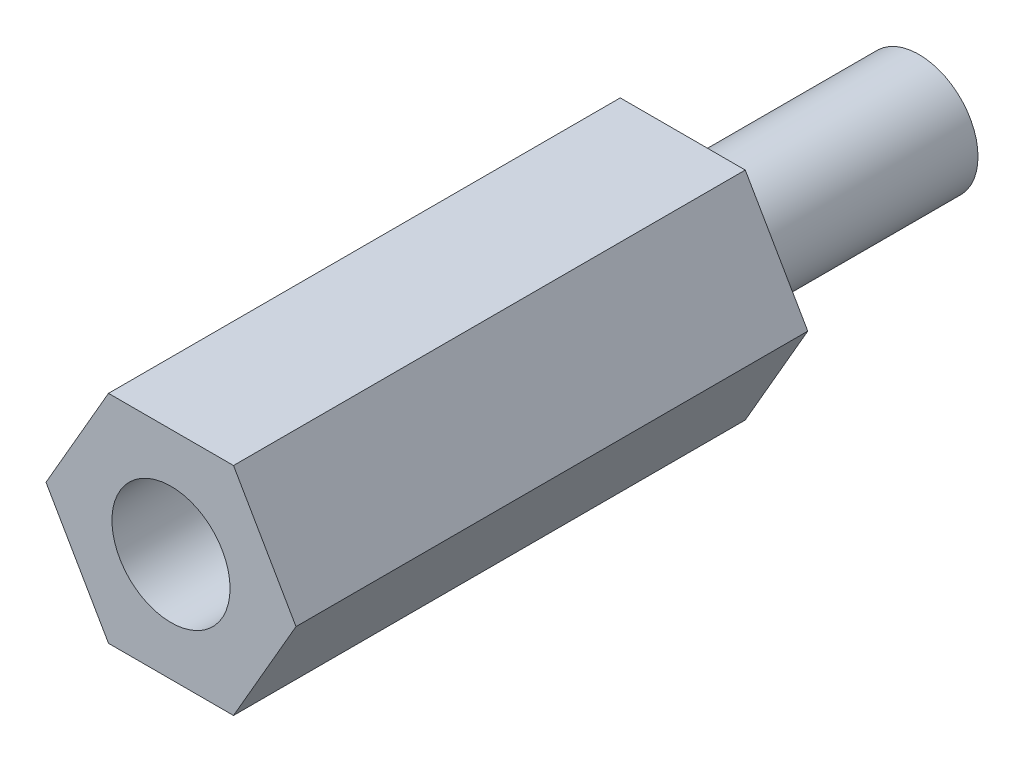
from build123d import *

# Parameters (mm, degrees)
BOSS_EXTRUDE1_DEPTH = 13
SKETCH1_3_R         = 1.5
BOSS_EXTRUDE2_DEPTH = 6
CUT_EXTRUDE1_START  = 13
SKETCH1_4_R         = 1.5
CUT_EXTRUDE1_DEPTH  = 6


with BuildPart() as part:
    # Sketch1 → Boss-Extrude1 (new body)
    with BuildSketch(Plane.XY):
        Polygon((1.58771324, -2.75), (3.175426481, 0), (1.58771324, 2.75), (-1.58771324, 2.75), (-3.175426481, 0), (-1.58771324, -2.75), align=None)
    extrude(amount=BOSS_EXTRUDE1_DEPTH)

    # Sketch1<3> → Boss-Extrude2 (add)
    with BuildSketch(Plane.XY):
        Circle(SKETCH1_3_R)
    extrude(amount=-BOSS_EXTRUDE2_DEPTH)

    # Sketch1<4> → Cut-Extrude1 (cut)
    with BuildSketch(Plane.XY.offset(CUT_EXTRUDE1_START)):
        Circle(SKETCH1_4_R)
    extrude(amount=-CUT_EXTRUDE1_DEPTH, mode=Mode.SUBTRACT)


solid = part.part
